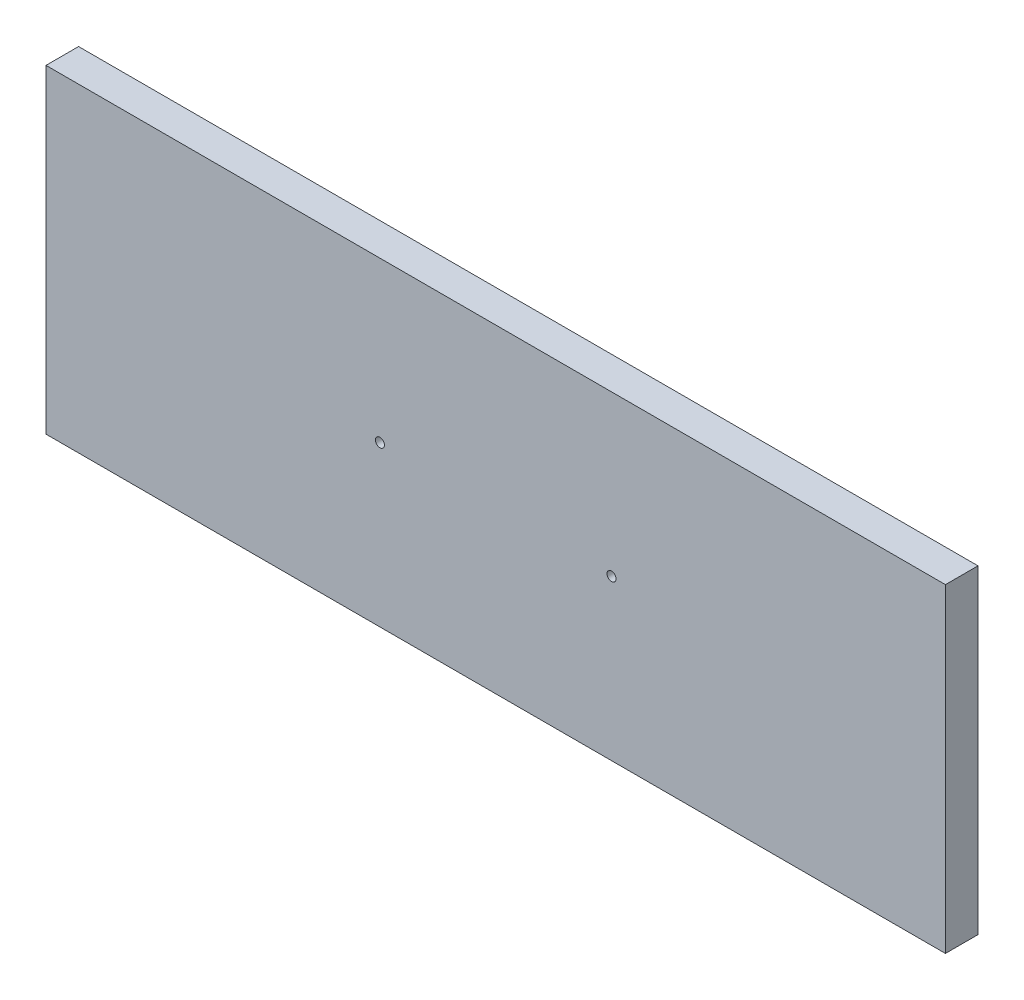
from build123d import *

# Parameters (mm, degrees)
SKETCH1_W           = 497
SKETCH1_H           = 176.5
BOSS_EXTRUDE1_DEPTH = 18
SKETCH3_R           = 2.5
CUT_EXTRUDE2_DEPTH  = 61


with BuildPart() as part:
    # Sketch1 → Boss-Extrude1 (new body)
    with BuildSketch(Plane.XY):
        with Locations((0, -661.75)):
            Rectangle(SKETCH1_W, SKETCH1_H)
    extrude(amount=BOSS_EXTRUDE1_DEPTH)

    # Sketch3 → Cut-Extrude2 (cut)
    with BuildSketch(Plane.XY):
        with Locations(Location((64, -661.75, 0), (0, 0, 180))):
            Circle(SKETCH3_R)
        with Locations(Location((-64, -661.75, 0), (0, 0, 180))):
            Circle(SKETCH3_R)
    extrude(amount=CUT_EXTRUDE2_DEPTH, mode=Mode.SUBTRACT)


solid = part.part
